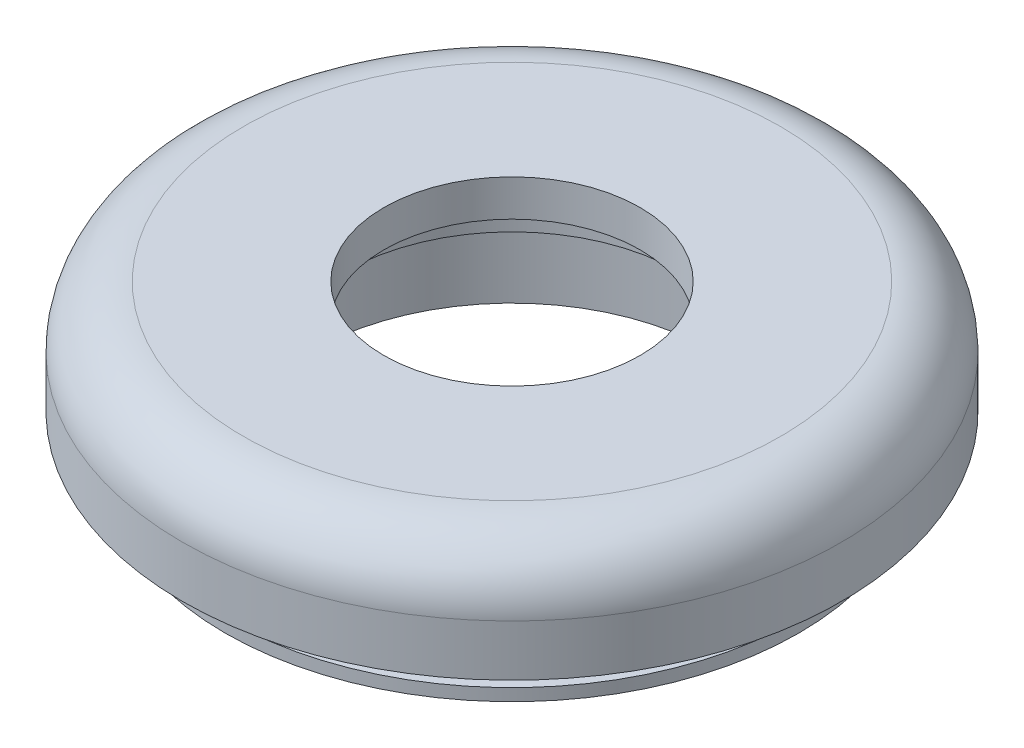
from build123d import *

# Parameters (mm, degrees)
FILLET_1_R = 5


with BuildPart() as part:
    # 草图2 → 旋转1 (revolve)
    with BuildSketch(Plane.XY, mode=Mode.PRIVATE) as revolve_1_sk:
        Polygon((-13.75, 0), (-13.75, 3.2), (-10.5, 3.2), (-10.5, 6.2), (-27, 6.2), (-27, -3), (-20.9, -3), (-20.9, -6), (-23.5, -6), (-23.5, -7), (-16.5, -7), (-16.5, 0), align=None)
    revolve(revolve_1_sk.sketch.rotate(Axis((0, 0, 0), (0, 1, 0)), 270), axis=Axis((0, 0, 0), (0, 1, 0)))

    # 圆角1
    fillet_1_edges = [part.edges().sort_by_distance(p)[0] for p in [
        (0, 6.2, 27),
    ]]
    fillet(fillet_1_edges, radius=FILLET_1_R)


solid = part.part
